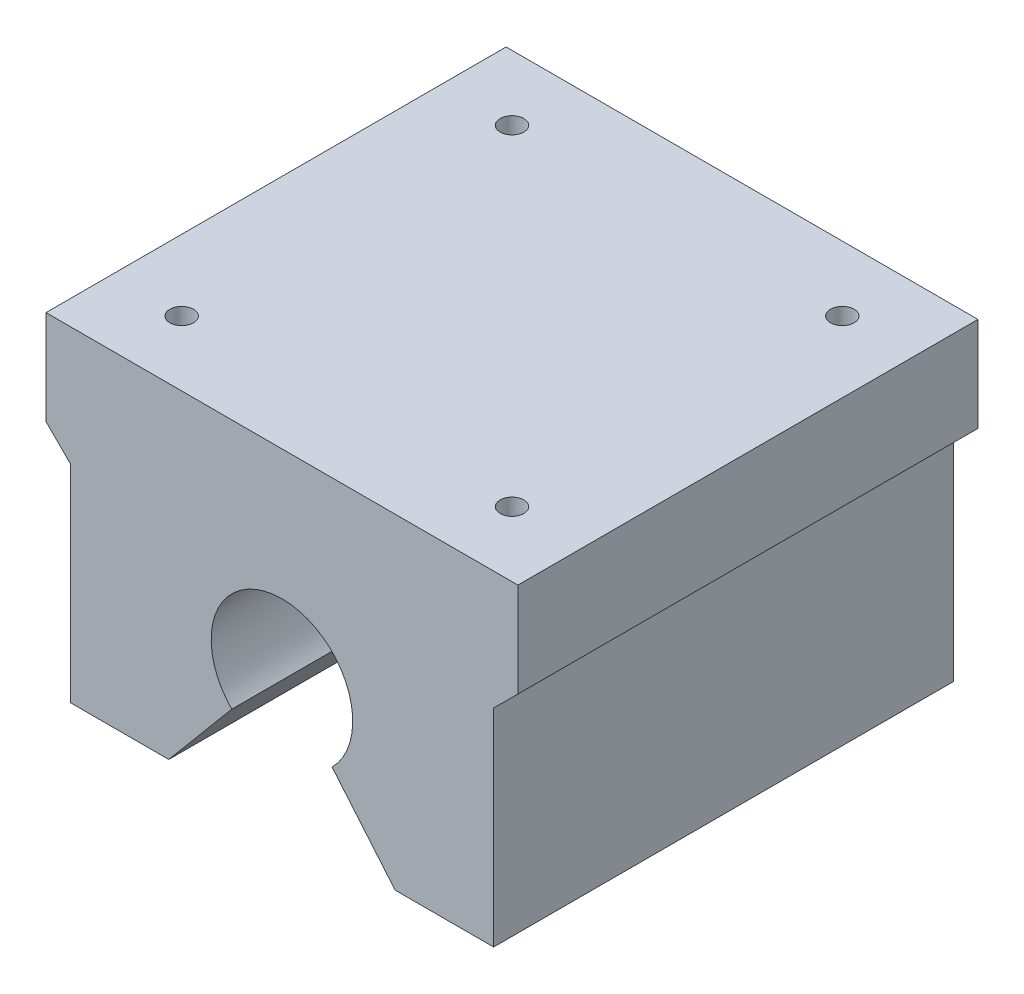
from build123d import *

# Parameters (mm, degrees)
BOSS_EXTRUDE1_DEPTH = 39
SKETCH2_R           = 1
CUT_EXTRUDE1_DEPTH  = 10


with BuildPart() as part:
    # Sketch1 → Boss-Extrude1 (new body)
    with BuildSketch(Plane.XY):
        with BuildLine():
            Line((20, 17), (-20, 17))
            Line((-20, 17), (-20, 9))
            Line((-20, 9), (-17.943455856, 6.943455856))
            Line((-17.943455856, 6.943455856), (-17.943455856, -10.6))
            Line((-17.943455856, -10.6), (-9.590643782, -10.6))
            Line((-9.590643782, -10.6), (-4.25, -4.235268587))
            ThreePointArc((-4.25, -4.235268587), (0, 6), (4.25, -4.235268587))
            Line((4.25, -4.235268587), (9.590643782, -10.6))
            Line((9.590643782, -10.6), (17.943455856, -10.6))
            Line((17.943455856, -10.6), (17.943455856, 6.943455856))
            Line((17.943455856, 6.943455856), (20, 9))
            Line((20, 9), (20, 17))
        make_face()
    extrude(amount=BOSS_EXTRUDE1_DEPTH)

    # Sketch2 → Cut-Extrude1 (cut)
    with BuildSketch(Plane(origin=(0, 17, 0), x_dir=(1, 0, 0), z_dir=(0, 1, 0))):
        with Locations(Location((-14, -33.5, 0), (0, 0, 270))):
            Circle(SKETCH2_R)
        with Locations(Location((14, -33.5, 0), (0, 0, 270))):
            Circle(SKETCH2_R)
        with Locations(Location((-14, -5.5, 0), (0, 0, 270))):
            Circle(SKETCH2_R)
        with Locations(Location((14, -5.5, 0), (0, 0, 270))):
            Circle(SKETCH2_R)
    extrude(amount=-CUT_EXTRUDE1_DEPTH, mode=Mode.SUBTRACT)


solid = part.part
